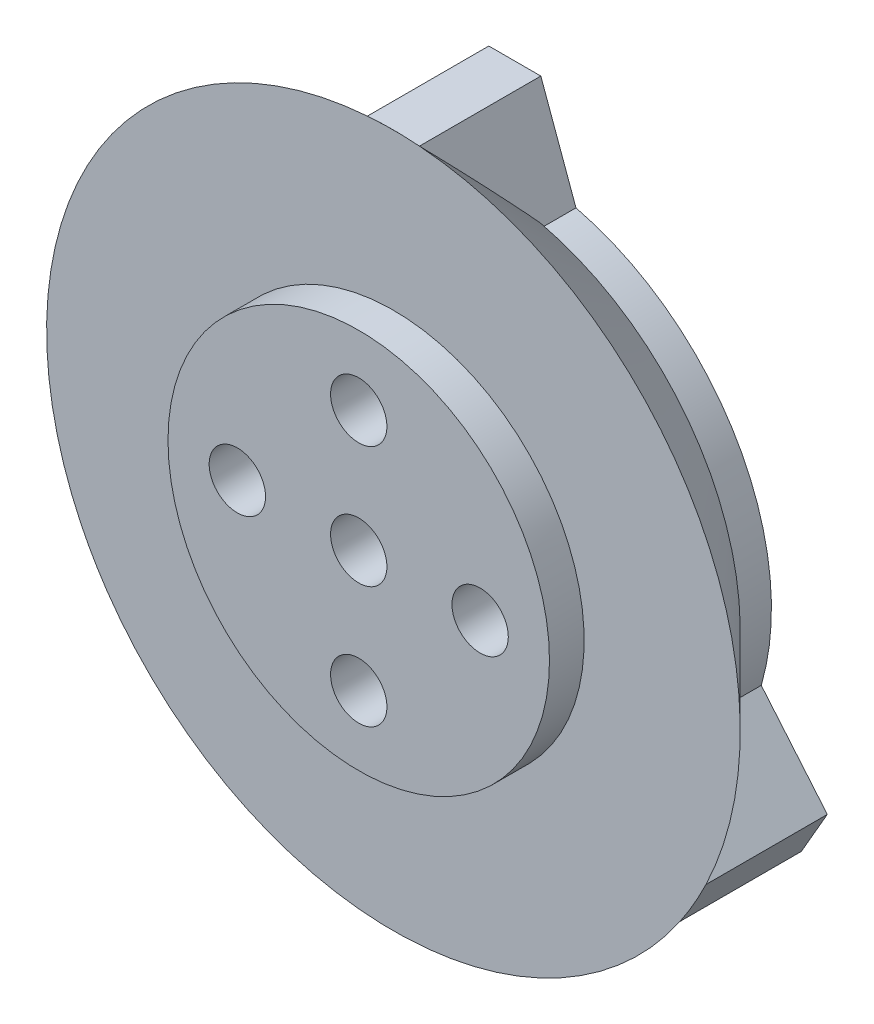
from build123d import *

# Parameters (mm, degrees)
ESQUISSE3_R                  = 14.8
BOSS_EXTRU_1_DEPTH           = 2
BOSS_EXTRU_2_REACH           = 31.138
R_P_TITION_CIRCULAIRE1_COUNT = 3
ENL_V_MAT_EXTRU_1_DEPTH      = 30.137604569
ENL_V_MAT_EXTRU_1_DEPTH_BACK = 30.137604569
ESQUISSE5_R                  = 1.625
BOSS_EXTRU_3_START           = 2
ESQUISSE6_R                  = 11
ESQUISSE6_R_2                = 1.625
BOSS_EXTRU_3_DEPTH           = 2


with BuildPart() as part:
    # Esquisse2 → Révolution1 (revolve)
    with BuildSketch(Plane(origin=(0, 0, 0), x_dir=(0, 0, -1), z_dir=(1, 0, 0)), mode=Mode.PRIVATE) as r_volution1_sk:
        Polygon((0, 0), (0, 20), (5, 15), (5, 0), align=None)
    revolve(r_volution1_sk.sketch.rotate(Axis((0, 0, 0), (0, 0, -1)), 90), axis=Axis((0, 0, 0), (0, 0, -1)))

    # Esquisse3 → Boss.-Extru.1 (add)
    with BuildSketch(Plane(origin=(0, 0, -5), x_dir=(-1, 0, 0), z_dir=(0, 0, -1))):
        Circle(ESQUISSE3_R)
    extrude(amount=BOSS_EXTRU_1_DEPTH)

    # Boss.-Extru.2: up to this face of the body (flat: up to its plane)
    boss_extru_2_end = Plane(part.part.faces().sort_by_distance((0, 0, -7))[0])
    # Esquisse4 → Boss.-Extru.2 (add, up to the picked face)
    with BuildSketch(Plane.XY, mode=Mode.PRIVATE) as boss_extru_2_sk1:
        with BuildLine():
            Line((1.5, 19.943670675), (-1.5, 19.943670675))
            Line((-1.5, 19.943670675), (-3.52737474, 14.373504355))
            ThreePointArc((-3.52737474, 14.373504355), (0, 14.8), (3.52737474, 14.373504355))
            Line((3.52737474, 14.373504355), (1.5, 19.943670675))
        make_face()
    boss_extru_2_tool1 = split(extrude(boss_extru_2_sk1.sketch, amount=-BOSS_EXTRU_2_REACH, mode=Mode.PRIVATE), bisect_by=boss_extru_2_end, keep=Keep.BOTH, mode=Mode.PRIVATE)
    boss_extru_2 = boss_extru_2_tool1.solids().sort_by(Axis((0, 16.957577, 0), (0, 0, -1)))[0]
    add(boss_extru_2)

    # Répétition circulaire1: Boss.-Extru.2 ×3 about axis
    r_p_tition_circulaire1_axis = Axis((0, 0, 0), (0, 0, 1))
    for i in range(1, R_P_TITION_CIRCULAIRE1_COUNT):
        add(boss_extru_2.rotate(r_p_tition_circulaire1_axis, i * 360 / R_P_TITION_CIRCULAIRE1_COUNT))

    # Esquisse5 → Enlèv. mat.-Extru.1 (cut, two sides: drawn at the far end of the back side and taken through both)
    with BuildSketch(Plane.XY.offset(-ENL_V_MAT_EXTRU_1_DEPTH_BACK)):
        with Locations((0, 7)):
            Circle(ESQUISSE5_R)
        Circle(ESQUISSE5_R)
        with Locations((7, 0)):
            Circle(ESQUISSE5_R)
        with Locations((0, -7)):
            Circle(ESQUISSE5_R)
        with Locations((-7, 0)):
            Circle(ESQUISSE5_R)
    extrude(amount=ENL_V_MAT_EXTRU_1_DEPTH + ENL_V_MAT_EXTRU_1_DEPTH_BACK, mode=Mode.SUBTRACT)

    # Esquisse6 → Boss.-Extru.3 (add)
    with BuildSketch(Plane.XY.offset(BOSS_EXTRU_3_START)):
        with Locations(Location((0, 0, 0), (0, 0, 180))):
            Circle(ESQUISSE6_R)
        with Locations((0, 7)):
            Circle(ESQUISSE6_R_2, mode=Mode.SUBTRACT)
        with Locations((0, -7)):
            Circle(ESQUISSE6_R_2, mode=Mode.SUBTRACT)
        Circle(ESQUISSE6_R_2, mode=Mode.SUBTRACT)
        with Locations((7, 0)):
            Circle(ESQUISSE6_R_2, mode=Mode.SUBTRACT)
        with Locations((-7, 0)):
            Circle(ESQUISSE6_R_2, mode=Mode.SUBTRACT)
    extrude(amount=-BOSS_EXTRU_3_DEPTH)


solid = part.part
